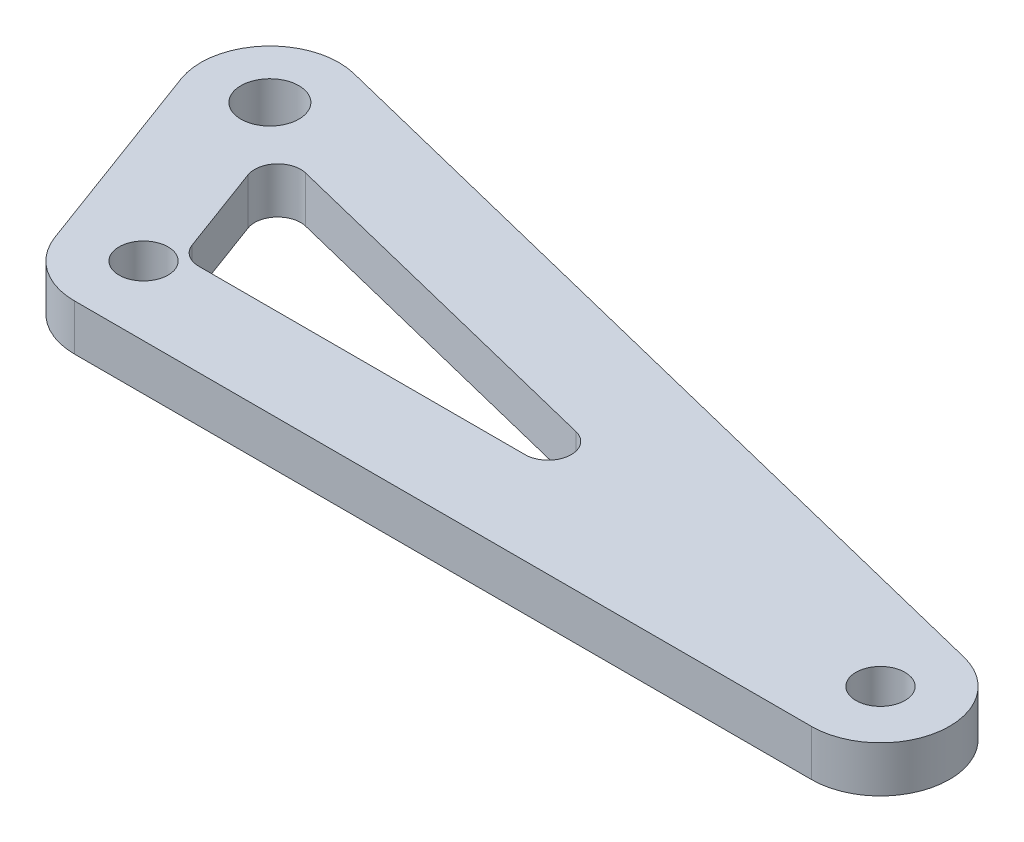
from build123d import *

# Parameters (mm, degrees)
SKETCH1_R           = 3.3782
SKETCH1_R_2         = 9.525
SKETCH1_R_3         = 4
BOSS_EXTRUDE2_DEPTH = 6.35


with BuildPart() as part:
    # Sketch1 → Boss-Extrude2 (new body)
    # profile 1 of 4: a face of its own
    with BuildSketch(Plane(origin=(0, 0, 0), x_dir=(1, 0, 0), z_dir=(0, 1, 0))):
        with BuildLine():
            ThreePointArc((-0.701449718, 27.635062977), (-8.547313496, 18.259236264), (-19.159429046, 24.329385234))
            Line((-19.159429046, 24.329385234), (-8.932978817, -3.305679122))
            ThreePointArc((-8.932978817, -3.305679122), (-7.856533502, 5.385211819), (-0.13896483, 9.523986234))
            Line((-0.13896483, 9.523986234), (-3.087221692, 17.491097626))
            ThreePointArc((-3.087221692, 17.491097626), (-2.476851738, 20.708780169), (0.652372477, 21.67521084))
            Line((0.652372477, 21.67521084), (50.178397804, 9.432220088))
            ThreePointArc((50.178397804, 9.432220088), (52.568182882, 5.966218669), (49.41646321, 3.175))
            Line((49.41646321, 3.175), (8.980256121, 3.175))
            ThreePointArc((8.980256121, 3.175), (9.387826281, 1.610696347), (9.525, 0))
            ThreePointArc((9.525, 0), (6.735192091, -6.735192091), (0, -9.525))
            Line((0, -9.525), (101.56444, -9.525))
            ThreePointArc((101.56444, -9.525), (92.109281021, 1.151344291), (103.850244371, 9.24666012))
            Line((103.850244371, 9.24666012), (-7.94064525, 36.881723073))
            ThreePointArc((-7.94064525, 36.881723073), (-2.7265193, 33.506746613), (-0.701449718, 27.635062977))
        make_face()
    # profile 2 of 4: a face of its own
    with BuildSketch(Plane(origin=(0, 0, 0), x_dir=(1, 0, 0), z_dir=(0, 1, 0))):
        with BuildLine():
            ThreePointArc((-0.13896483, 9.523986234), (-7.856533502, 5.385211819), (-8.932978817, -3.305679122))
            ThreePointArc((-8.932978817, -3.305679122), (-5.442381435, -7.817039678), (0, -9.525))
            ThreePointArc((0, -9.525), (6.735192091, -6.735192091), (9.525, 0))
            ThreePointArc((9.525, 0), (9.387826281, 1.610696347), (8.980256121, 3.175))
            Line((8.980256121, 3.175), (4.420998548, 3.175))
            ThreePointArc((4.420998548, 3.175), (2.60687144, 3.744320082), (1.443338974, 5.248106875))
            Line((1.443338974, 5.248106875), (-0.13896483, 9.523986234))
        make_face()
        with Locations(Location((0, 0, 0), (0, 0, 270))):
            Circle(SKETCH1_R, mode=Mode.SUBTRACT)
    # profile 3 of 4: a face of its own
    with BuildSketch(Plane(origin=(0, 0, 0), x_dir=(1, 0, 0), z_dir=(0, 1, 0))):
        with Locations((101.56444, 0)):
            Circle(SKETCH1_R_2)
        with Locations(Location((101.56444, 0, 0), (0, 0, 270))):
            Circle(SKETCH1_R, mode=Mode.SUBTRACT)
    # profile 4 of 4: a face of its own
    with BuildSketch(Plane(origin=(0, 0, 0), x_dir=(1, 0, 0), z_dir=(0, 1, 0))):
        with Locations((-10.226449718, 27.635062977)):
            Circle(SKETCH1_R_2)
        with Locations(Location((-10.226449718, 27.635062977, 0), (0, 0, 270))):
            Circle(SKETCH1_R_3, mode=Mode.SUBTRACT)
    extrude(amount=BOSS_EXTRUDE2_DEPTH)


solid = part.part
